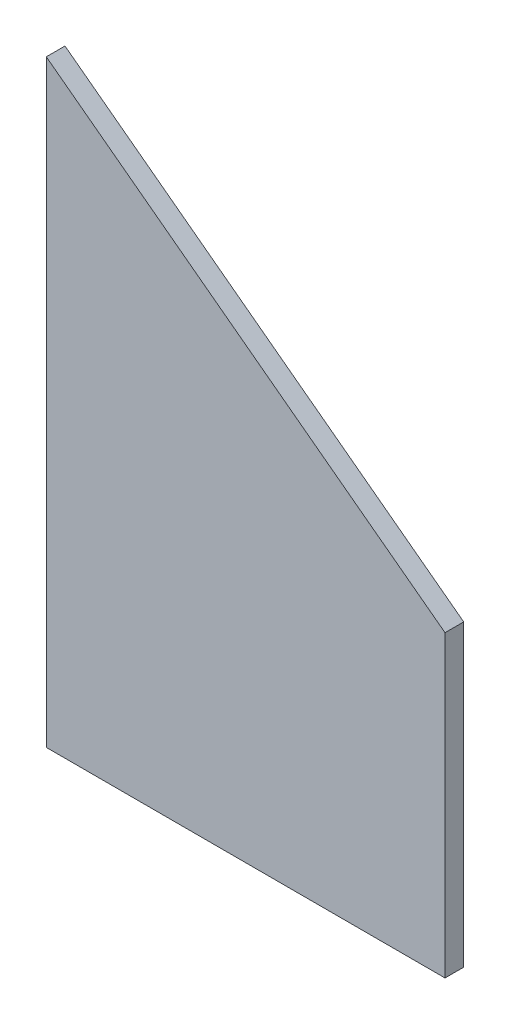
from build123d import *

# Parameters (mm, degrees)
BOSS_EXTRUDE1_DEPTH = 4.7625


with BuildPart() as part:
    # Sketch1 → Boss-Extrude1 (new body)
    with BuildSketch(Plane.XY):
        Polygon((101.6, -76.283437785), (0, -76.2), (0, 76.2), (101.6, -0.083437785), align=None)
    extrude(amount=BOSS_EXTRUDE1_DEPTH)


solid = part.part
